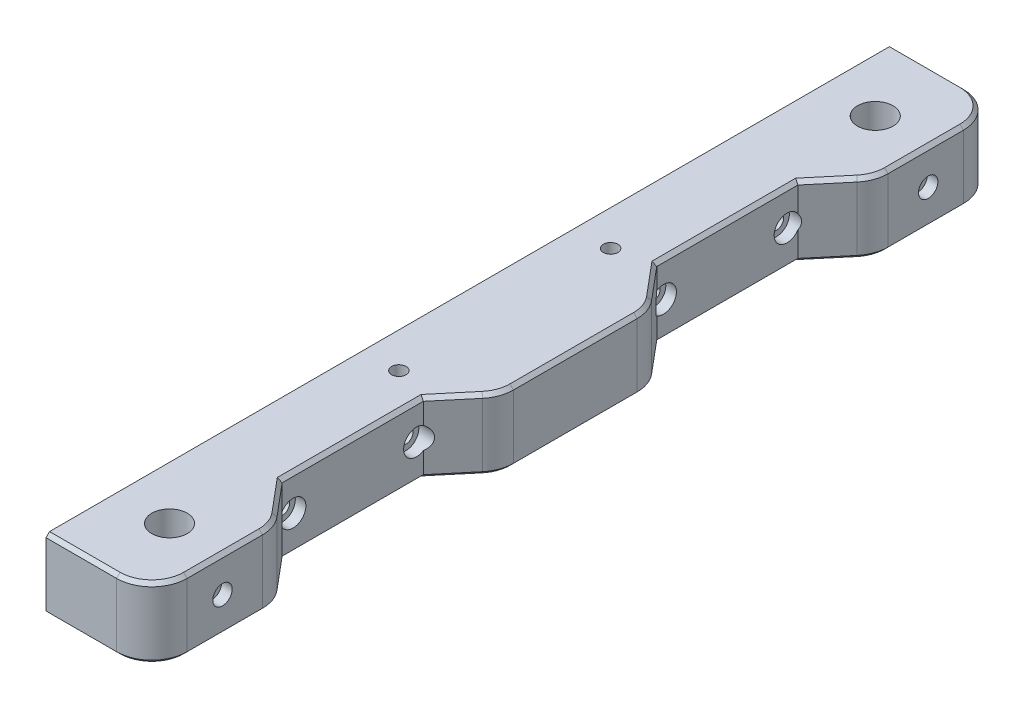
from build123d import *

# Parameters (mm, degrees)
SKETCH1_W               = 240
SKETCH1_H               = 20
BOSS_EXTRUDE1_DEPTH     = 30
SKETCH2_R               = 5.025
CUT_EXTRUDE1_DEPTH      = 20
SKETCH3_R               = 2.05
CUT_EXTRUDE2_DEPTH      = 30
CUT_EXTRUDE5_DEPTH      = 32.5
FILLET1_R               = 10
FILLET2_R               = 10
CHAMFER1_SIZE           = 1
CHAMFER2_SIZE           = 1
CUT_EXTRUDE9_DEPTH      = 3
CUT_EXTRUDE9_DEPTH_BACK = 3
SKETCH10_R              = 3.65
SKETCH11_R              = 1.5
CUT_EXTRUDE10_DEPTH     = 13
SKETCH12_R              = 2.75
SKETCH12_R_2            = 1.5
CUT_EXTRUDE11_DEPTH     = 3
SKETCH16_R              = 2.05
CUT_EXTRUDE12_DEPTH     = 40


with BuildPart() as part:
    # Sketch1 → Boss-Extrude1 (new body)
    with BuildSketch(Plane(origin=(0, 0, 0), x_dir=(0, 0, -1), z_dir=(1, 0, 0))):
        with Locations((47.599764496, 4.521643901)):
            Rectangle(SKETCH1_W, SKETCH1_H)
    extrude(amount=BOSS_EXTRUDE1_DEPTH)

    # Sketch2 → Cut-Extrude1 (cut)
    with BuildSketch(Plane(origin=(0, 14.521643901, 0), x_dir=(1, 0, 0), z_dir=(0, 1, 0))):
        with Locations(Location((15, 147.599764496, 0), (0, 0, 270))):
            Circle(SKETCH2_R)
        with Locations(Location((15, -52.400235504, 0), (0, 0, 270))):
            Circle(SKETCH2_R)
    extrude(amount=-CUT_EXTRUDE1_DEPTH, mode=Mode.SUBTRACT)

    # Sketch3 → Cut-Extrude2 (cut)
    with BuildSketch(Plane(origin=(30, 0, 0), x_dir=(0, 0, -1), z_dir=(1, 0, 0))):
        with Locations((117.599764496, 4.521643901)):
            Circle(SKETCH3_R)
        with Locations((-22.400235504, 4.521643901)):
            Circle(SKETCH3_R)
        with Locations((12.599764496, 4.521643901)):
            Circle(SKETCH3_R)
        with Locations((82.599764496, 4.521643901)):
            Circle(SKETCH3_R)
    extrude(amount=-CUT_EXTRUDE2_DEPTH, mode=Mode.SUBTRACT)

    # Sketch6 → Cut-Extrude5 (cut)
    with BuildSketch(Plane.XZ.offset(5.478356099)):
        Polygon((30, 37.400235504), (20, 25.482699578), (20, -14.517300422), (30, -26.434836348), align=None)
        Polygon((30, -68.764692644), (20, -80.68222857), (20, -120.68222857), (30, -132.599764496), align=None)
    extrude(amount=-CUT_EXTRUDE5_DEPTH, mode=Mode.SUBTRACT)

    # Fillet1
    fillet1_edges = [part.edges().sort_by_distance(p)[0] for p in [
        (30, 4.521643901, -26.434836348),
        (30, 4.521643901, -68.764692644),
    ]]
    fillet(fillet1_edges, radius=FILLET1_R)

    # Fillet2
    fillet2_edges = [part.edges().sort_by_distance(p)[0] for p in [
        (30, 4.521643901, 72.400235504),
        (30, 4.521643901, -167.599764496),
        (30, 4.521643901, 37.400235504),
        (30, 4.521643901, -132.599764496),
    ]]
    fillet(fillet2_edges, radius=FILLET2_R)

    # Chamfer1
    chamfer1_edges = [part.edges().sort_by_distance(p)[0] for p in [
        (30, -5.478356099, 51.720086675),
        (23.830222216, -5.478356099, 30.047380664),
        (10, -5.478356099, 72.400235504),
        (10, -5.478356099, -167.599764496),
        (30, -5.478356099, -146.919615667),
        (29.396926208, -5.478356099, 37.619736413),
        (29.396926208, -5.478356099, -132.819265405),
        (27.071067812, -5.478356099, -164.670832308),
        (27.071067812, -5.478356099, 69.471303316),
        (20, -5.478356099, 5.482699578),
        (23.830222216, -5.478356099, -19.081981508),
        (20, -5.478356099, -100.68222857),
        (23.830222216, -5.478356099, -125.246909656),
        (30, -5.478356099, -47.599764496),
        (23.830222216, -5.478356099, -76.117547484),
        (29.396926208, -5.478356099, -68.545191735),
        (29.396926208, -5.478356099, -26.654337257),
    ]]
    chamfer(chamfer1_edges, length=CHAMFER1_SIZE)

    # Chamfer2
    chamfer2_edges = [part.edges().sort_by_distance(p)[0] for p in [
        (29.396926208, 14.521643901, -26.654337257),
        (30, 14.521643901, 51.720086675),
        (10, 14.521643901, 72.400235504),
        (30, 14.521643901, -146.919615667),
        (10, 14.521643901, -167.599764496),
        (23.830222216, 14.521643901, 30.047380664),
        (29.396926208, 14.521643901, 37.619736413),
        (29.396926208, 14.521643901, -132.819265405),
        (27.071067812, 14.521643901, -164.670832308),
        (27.071067812, 14.521643901, 69.471303316),
        (23.830222216, 14.521643901, -19.081981508),
        (20, 14.521643901, 5.482699578),
        (23.830222216, 14.521643901, -125.246909656),
        (20, 14.521643901, -100.68222857),
        (30, 14.521643901, -47.599764496),
        (23.830222216, 14.521643901, -76.117547484),
        (29.396926208, 14.521643901, -68.545191735),
    ]]
    chamfer(chamfer2_edges, length=CHAMFER2_SIZE)

    # Sketch10 → Cut-Extrude9 (cut, two sides: drawn at the far end of the back side and taken through both)
    with BuildSketch(Plane(origin=(20, 0, 0), x_dir=(0, 0, -1), z_dir=(1, 0, 0)).offset(-CUT_EXTRUDE9_DEPTH_BACK)):
        with Locations(Location((12.599764496, 4.521643901, 0), (0, 0, 301.691963515))):
            Circle(SKETCH10_R)
        with Locations(Location((-22.400235504, 4.521643901, 0), (0, 0, 147.61954983))):
            Circle(SKETCH10_R)
        with Locations(Location((82.599764496, 4.521643901, 0), (0, 0, 238.308036485))):
            Circle(SKETCH10_R)
        with Locations(Location((117.599764496, 4.521643901, 0), (0, 0, 327.61954983))):
            Circle(SKETCH10_R)
    extrude(amount=CUT_EXTRUDE9_DEPTH + CUT_EXTRUDE9_DEPTH_BACK, mode=Mode.SUBTRACT)

    # Sketch11 → Cut-Extrude10 (cut)
    with BuildSketch(Plane(origin=(30, 0, 0), x_dir=(0, 0, -1), z_dir=(1, 0, 0))):
        with Locations((147.599764496, 4.521643901)):
            Circle(SKETCH11_R)
        with Locations((-52.400235504, 4.521643901)):
            Circle(SKETCH11_R)
    extrude(amount=-CUT_EXTRUDE10_DEPTH, mode=Mode.SUBTRACT)

    # Sketch12 → Cut-Extrude11 (cut)
    # profile 1 of 2: a face of its own
    with BuildSketch(Plane(origin=(30, 0, 0), x_dir=(0, 0, -1), z_dir=(1, 0, 0))):
        with Locations((-52.400235504, 4.521643901)):
            Circle(SKETCH12_R)
        with Locations((-52.400235504, 4.521643901)):
            Circle(SKETCH12_R_2, mode=Mode.SUBTRACT)
    # profile 2 of 2: a face of its own
    with BuildSketch(Plane(origin=(30, 0, 0), x_dir=(0, 0, -1), z_dir=(1, 0, 0))):
        with Locations((147.599764496, 4.521643901)):
            Circle(SKETCH12_R)
        with Locations((147.599764496, 4.521643901)):
            Circle(SKETCH12_R_2, mode=Mode.SUBTRACT)
    extrude(amount=-CUT_EXTRUDE11_DEPTH, mode=Mode.SUBTRACT)

    # Sketch16 → Cut-Extrude12 (cut)
    with BuildSketch(Plane(origin=(0, 14.521643901, 0), x_dir=(1, 0, 0), z_dir=(0, 1, 0))):
        with Locations(Location((10, 77.599764496, 0), (0, 0, 270))):
            Circle(SKETCH16_R)
        with Locations(Location((10, 17.599764496, 0), (0, 0, 270))):
            Circle(SKETCH16_R)
    extrude(amount=-CUT_EXTRUDE12_DEPTH, mode=Mode.SUBTRACT)


solid = part.part
